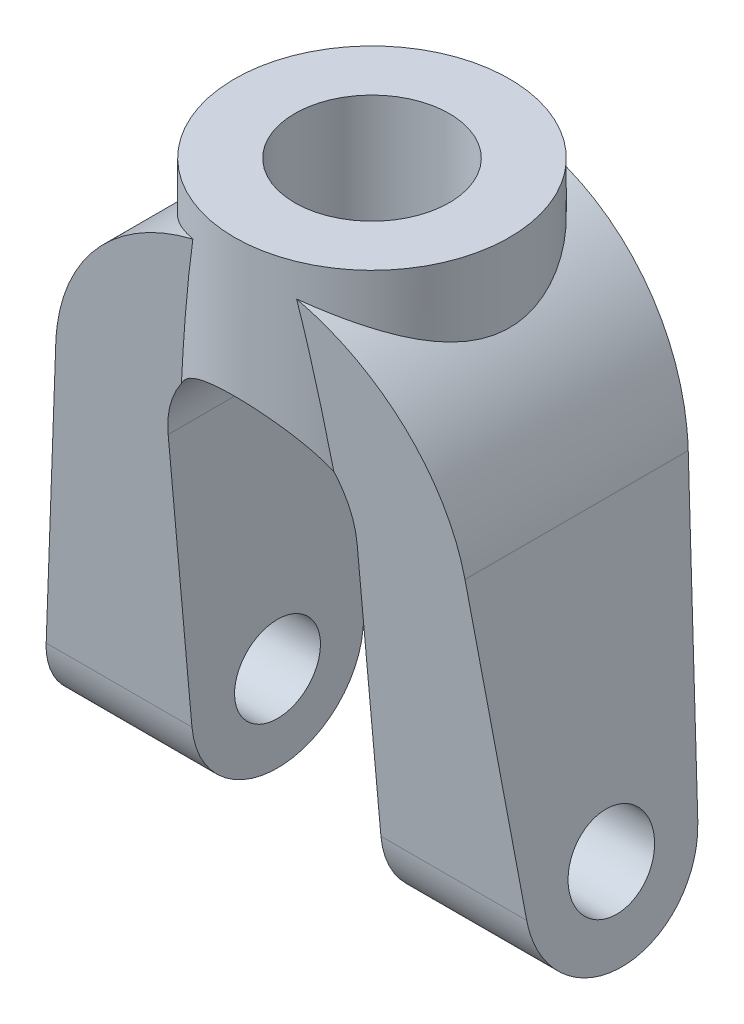
from build123d import *

# Parameters (mm, degrees)
BOSS_EXTRUDE2_DEPTH     = 20
CUT_EXTRUDE5_DEPTH      = 74.091191345
CUT_EXTRUDE5_DEPTH_BACK = 74.091191345
SKETCH3_OUTSIDE_W       = 61.06
SKETCH3_OUTSIDE_H       = 85.06
SKETCH3_OUTSIDE_R       = 5
BOSS_EXTRUDE3_START     = 40
SKETCH4_R               = 16
SKETCH4_R_2             = 9
BOSS_EXTRUDE3_DEPTH     = 27
SKETCH4_4_R             = 9
CUT_EXTRUDE7_DEPTH      = 70
CUT_EXTRUDE8_DEPTH      = 75.775144726
CUT_EXTRUDE8_DEPTH_BACK = 75.775144726


with BuildPart() as part:
    # Sketch1 → Boss-Extrude2 (new, symmetric)
    with BuildSketch(Plane.XY):
        with BuildLine():
            ThreePointArc((-11, 40), (0, 51), (11, 40))
            Line((11, 40), (11, 18.669270992))
            ThreePointArc((11, 18.669270992), (20.493901532, 27.510004003), (24, 40))
            ThreePointArc((24, 40), (23.955235162, 41.465164949), (23.821107639, 42.924864242))
            ThreePointArc((23.821107639, 42.924864242), (0, 64), (-23.821107639, 42.924864242))
            ThreePointArc((-23.821107639, 42.924864242), (-21.218172289, 28.784423121), (-11, 18.669270992))
            Line((-11, 18.669270992), (-11, 40))
        make_face()
        with BuildLine():
            ThreePointArc((24, 40), (20.493901532, 27.510004003), (11, 18.669270992))
            Line((11, 18.669270992), (11, 0))
            Line((11, 0), (29.091618247, 0))
            Line((29.091618247, 0), (23.821107639, 42.924864242))
            ThreePointArc((23.821107639, 42.924864242), (23.955235162, 41.465164949), (24, 40))
        make_face()
        with BuildLine():
            Line((-11, 0), (-11, 18.669270992))
            ThreePointArc((-11, 18.669270992), (-21.218172289, 28.784423121), (-23.821107639, 42.924864242))
            Line((-23.821107639, 42.924864242), (-29.091618247, 0))
            Line((-29.091618247, 0), (-11, 0))
        make_face()
    extrude(amount=BOSS_EXTRUDE2_DEPTH, both=True)

    # Sketch3 outside → Cut-Extrude5 (cut, two sides: drawn at the far end of the back side and taken through both)
    # profile 1 of 2: a face of its own
    with BuildSketch(Plane(origin=(0, 0, 0), x_dir=(0, 0, -1), z_dir=(1, 0, 0)).offset(-CUT_EXTRUDE5_DEPTH_BACK)):
        with Locations((0, 32)):
            Rectangle(SKETCH3_OUTSIDE_W, SKETCH3_OUTSIDE_H)
        with BuildLine():
            Line((-14.886153969, 64), (-9.959975113, 9.106190314))
            ThreePointArc((-9.959975113, 9.106190314), (0, 0), (9.959975113, 9.106190314))
            Line((9.959975113, 9.106190314), (14.886153969, 64))
            Line((14.886153969, 64), (-14.886153969, 64))
        make_face(mode=Mode.SUBTRACT)
    # profile 2 of 2: a face of its own
    with BuildSketch(Plane(origin=(0, 0, 0), x_dir=(0, 0, -1), z_dir=(1, 0, 0)).offset(-CUT_EXTRUDE5_DEPTH_BACK)):
        with Locations(Location((0, 10, 0), (0, 0, 90))):
            Circle(SKETCH3_OUTSIDE_R)
    extrude(amount=CUT_EXTRUDE5_DEPTH + CUT_EXTRUDE5_DEPTH_BACK, mode=Mode.SUBTRACT)

    # Sketch4 → Boss-Extrude3 (add)
    with BuildSketch(Plane(origin=(0, 0, 0), x_dir=(1, 0, 0), z_dir=(0, 1, 0)).offset(BOSS_EXTRUDE3_START)):
        with Locations(Location((0, 0, 0), (0, 0, 270))):
            Circle(SKETCH4_R)
        with Locations(Location((0, 0, 0), (0, 0, 270))):
            Circle(SKETCH4_R_2, mode=Mode.SUBTRACT)
    extrude(amount=BOSS_EXTRUDE3_DEPTH)

    # Sketch4<4> → Cut-Extrude7 (cut)
    with BuildSketch(Plane(origin=(0, 0, 0), x_dir=(1, 0, 0), z_dir=(0, 1, 0))):
        with Locations(Location((0, 0, 0), (0, 0, 270))):
            Circle(SKETCH4_4_R)
    extrude(amount=CUT_EXTRUDE7_DEPTH, mode=Mode.SUBTRACT)

    # Sketch5 → Cut-Extrude8 (cut, two sides: drawn at the far end of the back side and taken through both)
    with BuildSketch(Plane.XY.offset(-CUT_EXTRUDE8_DEPTH_BACK)):
        with BuildLine():
            Line((-11, 40), (11, 40))
            ThreePointArc((11, 40), (10.4539787, 43.422620245), (8.870121938, 46.505454388))
            ThreePointArc((8.870121938, 46.505454388), (-3.422620245, 50.4539787), (-11, 40))
        make_face()
    extrude(amount=CUT_EXTRUDE8_DEPTH + CUT_EXTRUDE8_DEPTH_BACK, mode=Mode.SUBTRACT)


solid = part.part
